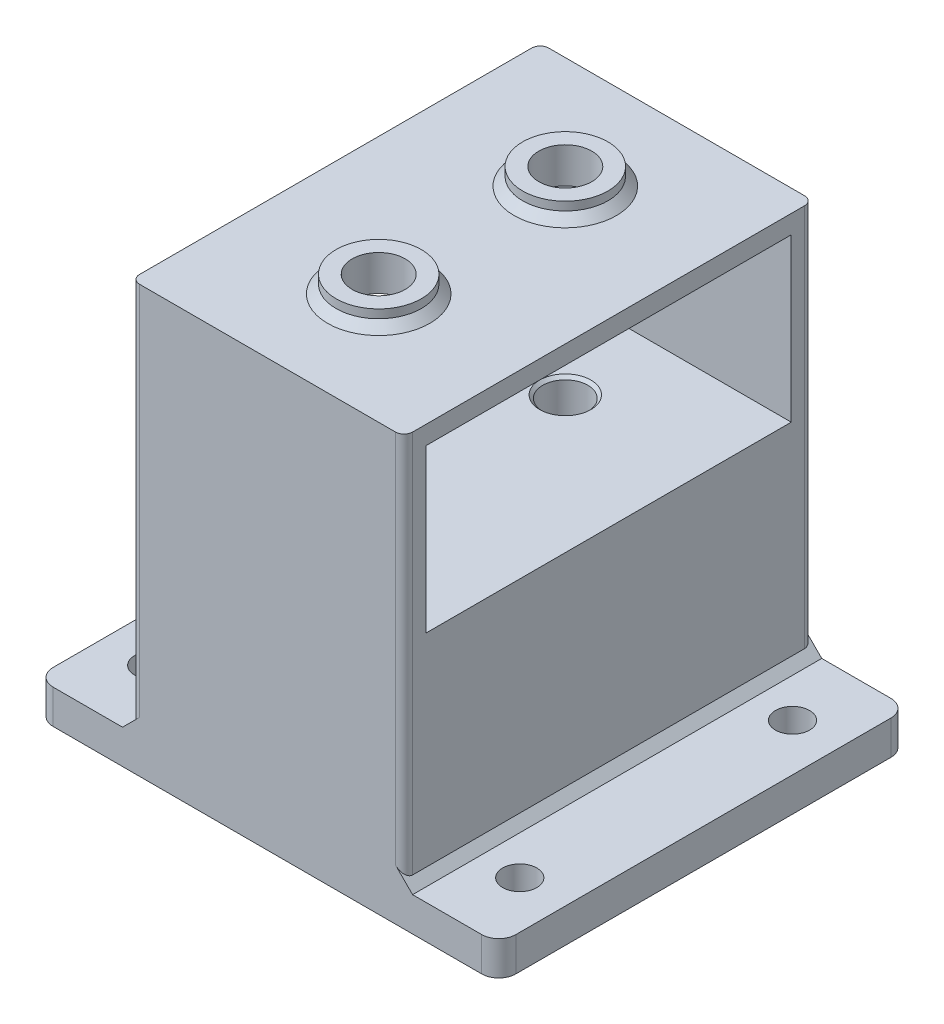
from build123d import *

# Parameters (mm, degrees)
SKETCH_1_W                    = 221.417168307
SKETCH_1_H                    = 240
EXTRUDE_1_DEPTH               = 20
SKETCH_2_W                    = 160.152997215
SKETCH_2_H                    = 240
EXTRUDE_2_DEPTH               = 230
SKETCH_3_W                    = 214.21
SKETCH_3_H                    = 95.18
CUT_EXTRUDE_1_DEPTH           = 660.673983169
HOLE_WIZARD_M30_1_D           = 26.5
HOLE_WIZARD_M30_1_DEPTH       = 50
HOLE_WIZARD_M30_1_CSINK_D     = 30.05
HOLE_WIZARD_M30_1_CSINK_ANGLE = 90
HOLE_WIZARD_M30_1_TIP         = 7.961403202
SKETCH_11_R                   = 15.562071092
CUT_EXTRUDE_3_DEPTH           = 20
SKETCH_12_R                   = 25
EXTRUDE_3_DEPTH               = 10
SKETCH_13_R                   = 15.562071092
CUT_EXTRUDE_4_DEPTH           = 29.5
SKETCH_14_W                   = 25
SKETCH_14_H                   = 240
EXTRUDE_4_DEPTH               = 20
SKETCH_15_R                   = 10
CUT_EXTRUDE_5_DEPTH           = 25
CHAMFER_1_SIZE                = 5
FILLET_1_R                    = 10
FILLET_2_R                    = 5


with BuildPart() as part:
    # 草图1 → 凸台-拉伸1 (new body)
    with BuildSketch(Plane(origin=(0, 370, 0), x_dir=(1, 0, 0), z_dir=(0, 1, 0))):
        with Locations((-989.291415847, 0)):
            Rectangle(SKETCH_1_W, SKETCH_1_H)
    extrude(amount=EXTRUDE_1_DEPTH)

    # 草图2 → 凸台-拉伸2 (add)
    with BuildSketch(Plane(origin=(0, 390, 0), x_dir=(1, 0, 0), z_dir=(0, 1, 0))):
        with Locations((-989.214917238, 0)):
            Rectangle(SKETCH_2_W, SKETCH_2_H)
    extrude(amount=EXTRUDE_2_DEPTH)

    # 草图3 → 切除-拉伸1 (cut, through all)
    with BuildSketch(Plane.ZY.offset(1069.291415846)):
        with Locations((0, 561.56)):
            Rectangle(SKETCH_3_W, SKETCH_3_H)
    extrude(amount=-CUT_EXTRUDE_1_DEPTH, mode=Mode.SUBTRACT)

    # M30 螺纹孔1
    with Locations(Plane(origin=(0, 513.97, 0), x_dir=(1, 0, 0), z_dir=(0, 1, 0))):
        with Locations((-989.291415846, 54.73), (-989.291415846, -54.73)):
            CounterSinkHole(HOLE_WIZARD_M30_1_D / 2, HOLE_WIZARD_M30_1_CSINK_D / 2, depth=HOLE_WIZARD_M30_1_DEPTH, counter_sink_angle=HOLE_WIZARD_M30_1_CSINK_ANGLE)
            with Locations((0, 0, -(HOLE_WIZARD_M30_1_DEPTH + HOLE_WIZARD_M30_1_TIP / 2))):  # 118° drill point
                Cone(0, HOLE_WIZARD_M30_1_D / 2, HOLE_WIZARD_M30_1_TIP, mode=Mode.SUBTRACT)

    # 草图11 → 切除-拉伸3 (cut)
    with BuildSketch(Plane(origin=(0, 620, 0), x_dir=(1, 0, 0), z_dir=(0, 1, 0))):
        with Locations(Location((-989.291415846, 54.73, 0), (0, 0, 270))):
            Circle(SKETCH_11_R)
        with Locations(Location((-989.291415846, -54.73, 0), (0, 0, 270))):
            Circle(SKETCH_11_R)
    extrude(amount=-CUT_EXTRUDE_3_DEPTH, mode=Mode.SUBTRACT)

    # 草图12 → 凸台-拉伸3 (add)
    with BuildSketch(Plane(origin=(0, 620, 0), x_dir=(1, 0, 0), z_dir=(0, 1, 0))):
        with Locations(Location((-989.291415846, 54.73, 0), (0, 0, 270))):
            Circle(SKETCH_12_R)
        with Locations(Location((-989.291415846, -54.73, 0), (0, 0, 270))):
            Circle(SKETCH_12_R)
    extrude(amount=EXTRUDE_3_DEPTH)

    # 草图13 → 切除-拉伸4 (cut, symmetric)
    with BuildSketch(Plane(origin=(0, 630, 0), x_dir=(1, 0, 0), z_dir=(0, 1, 0))):
        with Locations(Location((-989.291415846, 54.73, 0), (0, 0, 270))):
            Circle(SKETCH_13_R)
        with Locations(Location((-989.291415846, -54.73, 0), (0, 0, 270))):
            Circle(SKETCH_13_R)
    extrude(amount=CUT_EXTRUDE_4_DEPTH, both=True, mode=Mode.SUBTRACT)

    # 草图14 → 凸台-拉伸4 (add)
    with BuildSketch(Plane.XZ.offset(-370)):
        with Locations((-1112.5, 0)):
            Rectangle(SKETCH_14_W, SKETCH_14_H)
        with Locations((-866.082831693, 0)):
            Rectangle(SKETCH_14_W, SKETCH_14_H)
    extrude(amount=-EXTRUDE_4_DEPTH)

    # 草图15 → 切除-拉伸5 (cut, symmetric)
    with BuildSketch(Plane(origin=(0, 390, 0), x_dir=(1, 0, 0), z_dir=(0, 1, 0))):
        with Locations(Location((-1097.145707923, -80, 0), (0, 0, 270))):
            Circle(SKETCH_15_R)
        with Locations(Location((-1097.145707923, 80, 0), (0, 0, 270))):
            Circle(SKETCH_15_R)
    cut_extrude_5 = extrude(amount=CUT_EXTRUDE_5_DEPTH, both=True, mode=Mode.SUBTRACT)

    # 镜向1: 切除-拉伸5 across plane
    add(cut_extrude_5.mirror(Plane.ZY.offset(989.214917239)), mode=Mode.SUBTRACT)

    # 倒角1
    chamfer_1_edges = [part.edges().sort_by_distance(p)[0] for p in [
        (-1069.291415846, 390, 0),
        (-909.138418631, 390, 0),
        (-989.291415846, 620, -79.73),
        (-989.291415846, 620, 29.73),
    ]]
    chamfer(chamfer_1_edges, length=CHAMFER_1_SIZE)

    # 圆角1
    fillet_1_edges = [part.edges().sort_by_distance(p)[0] for p in [
        (-853.582831693, 380, -120),
        (-853.582831693, 380, 120),
        (-1125, 380, 120),
        (-1125, 380, -120),
    ]]
    fillet(fillet_1_edges, radius=FILLET_1_R)

    # 圆角2
    fillet_2_edges = [part.edges().sort_by_distance(p)[0] for p in [
        (-1069.291415846, 507.5, -120),
        (-1069.291415846, 507.5, 120),
        (-909.138418631, 507.5, 120),
        (-909.138418631, 507.5, -120),
    ]]
    fillet(fillet_2_edges, radius=FILLET_2_R)


solid = part.part
